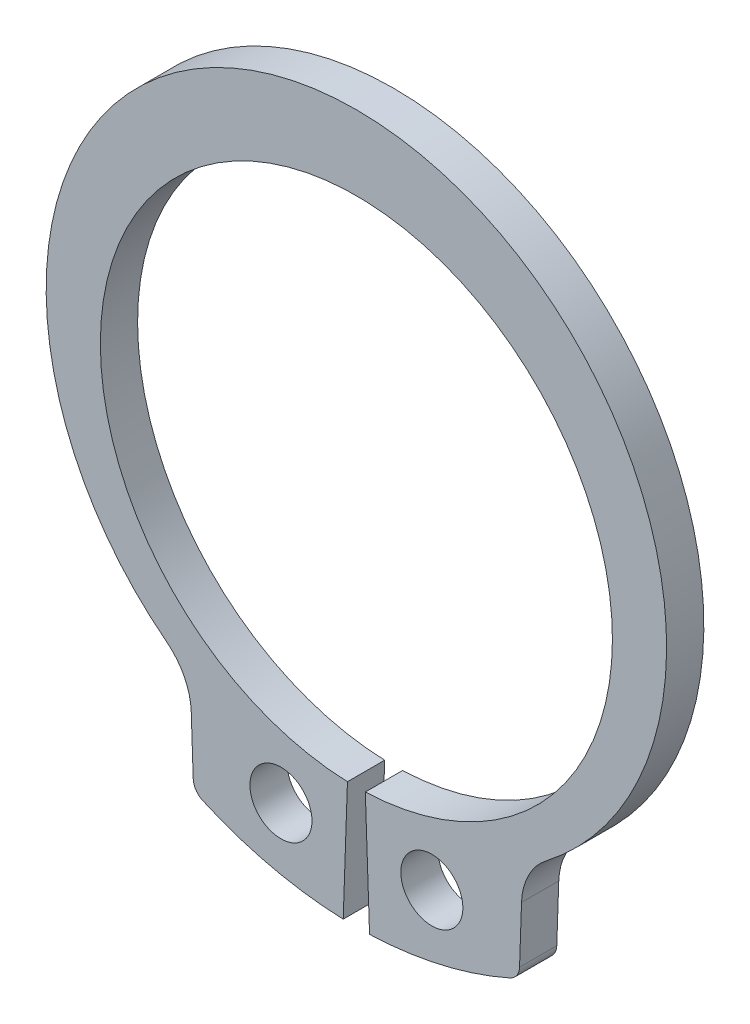
from build123d import *

# Parameters (mm, degrees)
SKETCH4_R           = 1
BOSS_EXTRUDE1_DEPTH = 0.6
FILLET1_R           = 2.065056386
FILLET2_R           = 0.516264097


with BuildPart() as part:
    # Sketch4 → Boss-Extrude1 (new, symmetric)
    with BuildSketch(Plane.XY):
        with BuildLine():
            Line((-5.246180053, -10.967229122), (-5.356700553, -7.785130647))
            ThreePointArc((-5.356700553, -7.785130647), (-9.598805691, 3.443313149), (0, 10.65))
            Line((0, 10.65), (0, 8.25))
            ThreePointArc((0, 8.25), (-8.248743485, 0.143982353), (-0.287920848, -8.244974323))
            Line((-0.287920848, -8.244974323), (-0.424287349, -12.15))
            ThreePointArc((-0.424287349, -12.15), (-2.896253939, -11.807380441), (-5.246180053, -10.967229122))
        make_face()
        with Locations((-2.430824062, -9.909926787)):
            Circle(SKETCH4_R, mode=Mode.SUBTRACT)
    extrude(amount=BOSS_EXTRUDE1_DEPTH, both=True)

    # Fillet1
    fillet1_edges = [part.edges().sort_by_distance(p)[0] for p in [
        (-5.356700553, -7.785130647, 0),
    ]]
    fillet(fillet1_edges, radius=FILLET1_R)

    # Fillet2
    fillet2_edges = [part.edges().sort_by_distance(p)[0] for p in [
        (-5.246180053, -10.967229122, 0),
    ]]
    fillet(fillet2_edges, radius=FILLET2_R)

    # Mirror1: part across plane


with BuildPart() as part_1:
    add(part.part)
    add(part.part.mirror(Plane(origin=(0, 10.65, 0.6), x_dir=(0, 0, 1), z_dir=(-1, 0, 0))))


solid = part_1.part
